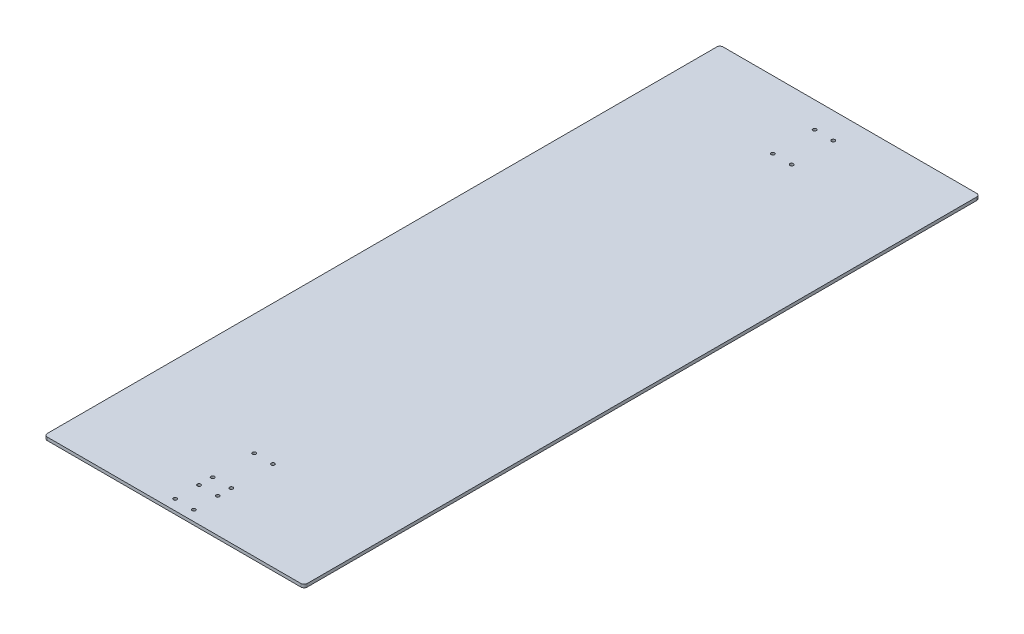
from build123d import *

# Parameters (mm, degrees)
SKETCH_1_W          = 250
SKETCH_1_H          = 650
EXTRUDE_1_DEPTH     = 3
SKETCH_3_R          = 1.65
CUT_EXTRUDE_2_DEPTH = 10
SKETCH_4_R          = 1.65
CUT_EXTRUDE_3_DEPTH = 3
FILLET_1_R          = 3


with BuildPart() as part:
    # 草图1 → 凸台-拉伸1 (new body)
    with BuildSketch(Plane(origin=(0, 0, 0), x_dir=(1, 0, 0), z_dir=(0, 1, 0))):
        Rectangle(SKETCH_1_W, SKETCH_1_H)
    extrude(amount=EXTRUDE_1_DEPTH)

    # 草图3 → 切除-拉伸2 (cut)
    with BuildSketch(Plane(origin=(0, 3, 0), x_dir=(1, 0, 0), z_dir=(0, 1, 0))):
        with Locations(Location((9, -279, 0), (0, 0, 270))):
            Circle(SKETCH_3_R)
        with Locations(Location((-9, -279, 0), (0, 0, 270))):
            Circle(SKETCH_3_R)
        with Locations(Location((9, -239, 0), (0, 0, 270))):
            Circle(SKETCH_3_R)
        with Locations(Location((-9, -239, 0), (0, 0, 270))):
            Circle(SKETCH_3_R)
        with Locations(Location((9, 300, 0), (0, 0, 270))):
            Circle(SKETCH_3_R)
        with Locations(Location((-9, 300, 0), (0, 0, 270))):
            Circle(SKETCH_3_R)
        with Locations(Location((9, 260, 0), (0, 0, 270))):
            Circle(SKETCH_3_R)
        with Locations(Location((-9, 260, 0), (0, 0, 270))):
            Circle(SKETCH_3_R)
    extrude(amount=-CUT_EXTRUDE_2_DEPTH, mode=Mode.SUBTRACT)

    # 草图4 → 切除-拉伸3 (cut)
    with BuildSketch(Plane(origin=(0, 3, 0), x_dir=(1, 0, 0), z_dir=(0, 1, 0))):
        with Locations(Location((9, -292, 0), (0, 0, 270))):
            Circle(SKETCH_4_R)
        with Locations(Location((-9, -292, 0), (0, 0, 270))):
            Circle(SKETCH_4_R)
        with Locations(Location((-9, -315, 0), (0, 0, 270))):
            Circle(SKETCH_4_R)
        with Locations(Location((9, -315, 0), (0, 0, 270))):
            Circle(SKETCH_4_R)
    extrude(amount=-CUT_EXTRUDE_3_DEPTH, mode=Mode.SUBTRACT)

    # 圆角1
    fillet_1_edges = [part.edges().sort_by_distance(p)[0] for p in [
        (125, 1.5, 325),
        (-125, 1.5, 325),
        (-125, 1.5, -325),
        (125, 1.5, -325),
    ]]
    fillet(fillet_1_edges, radius=FILLET_1_R)


solid = part.part
